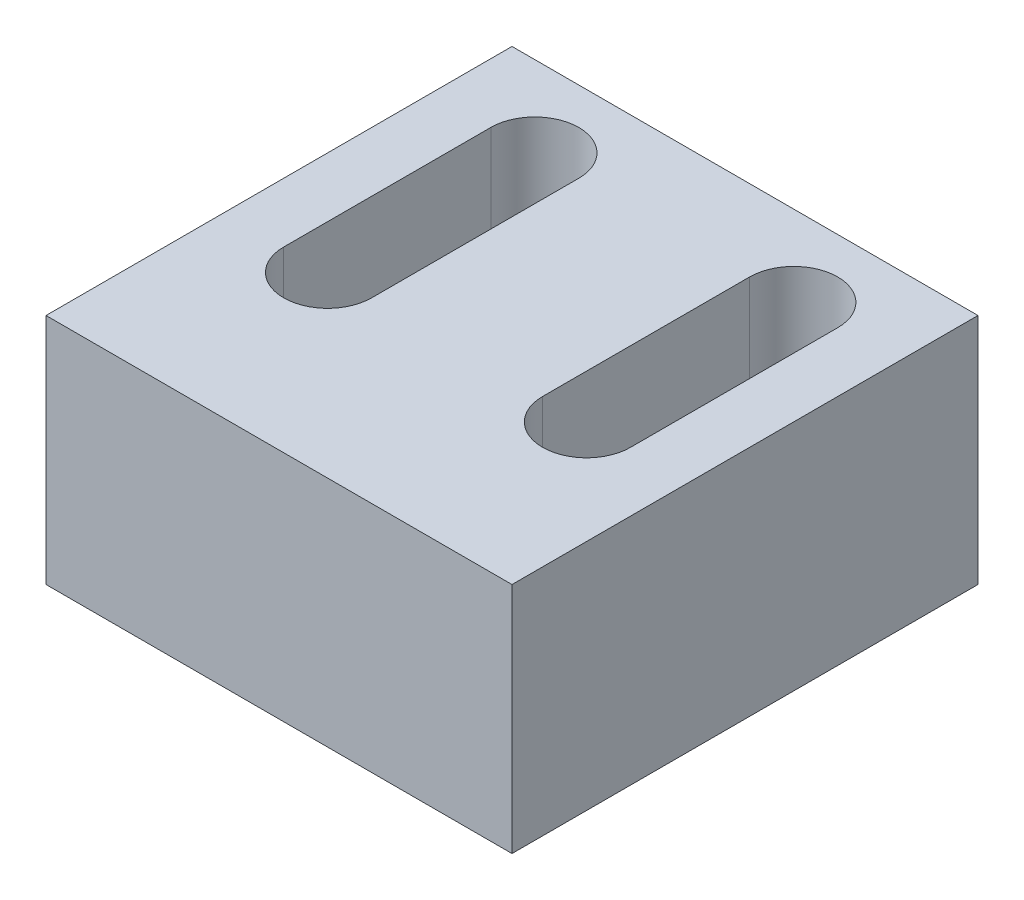
from build123d import *

# Parameters (mm, degrees)
SKETCH1_W           = 45
SKETCH1_H           = 22.5
BOSS_EXTRUDE1_DEPTH = 22.5
CUT_EXTRUDE1_DEPTH  = 45


with BuildPart() as part:
    # Sketch1 → Boss-Extrude1 (new, symmetric)
    with BuildSketch(Plane(origin=(0, 0, 0), x_dir=(0, 0, -1), z_dir=(1, 0, 0))):
        Rectangle(SKETCH1_W, SKETCH1_H)
    extrude(amount=BOSS_EXTRUDE1_DEPTH, both=True)

    # Sketch2 → Cut-Extrude1 (cut)
    with BuildSketch(Plane(origin=(0, 11.25, 0), x_dir=(1, 0, 0), z_dir=(0, 1, 0))):
        with BuildLine():
            Line((-8.25, 14.7), (-8.25, -5.3))
            ThreePointArc((-8.25, -5.3), (-12.5, -9.55), (-16.75, -5.3))
            Line((-16.75, -5.3), (-16.75, 14.7))
            ThreePointArc((-16.75, 14.7), (-12.5, 18.95), (-8.25, 14.7))
        make_face()
        with BuildLine():
            Line((8.25, 14.7), (8.25, -5.3))
            ThreePointArc((8.25, -5.3), (12.5, -9.55), (16.75, -5.3))
            Line((16.75, -5.3), (16.75, 14.7))
            ThreePointArc((16.75, 14.7), (12.5, 18.95), (8.25, 14.7))
        make_face()
    extrude(amount=-CUT_EXTRUDE1_DEPTH, mode=Mode.SUBTRACT)


solid = part.part
